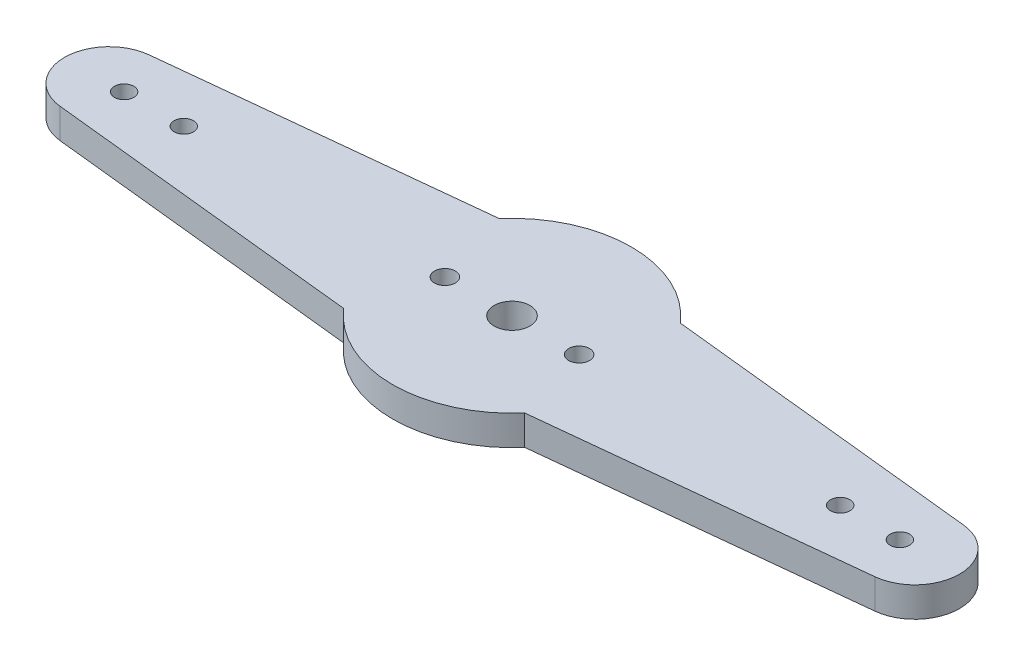
from build123d import *

# Parameters (mm, degrees)
BOSS_EXTRU_1_DEPTH      = 10
SYM_TRIE8_COPY_1_DEPTH  = 10
ESQUISSE2_R             = 3.5
ESQUISSE2_R_2           = 6
ESQUISSE2_R_3           = 3.25
ENL_V_MAT_EXTRU_1_DEPTH = 10


with BuildPart() as part:
    # Esquisse1 → Boss.-Extru.1 (new body)
    with BuildSketch(Plane(origin=(0, 0, 0), x_dir=(1, 0, 0), z_dir=(0, 1, 0))):
        with BuildLine():
            Line((-30.324962458, 26.084413966), (-136.567926949, 14.917828431))
            ThreePointArc((-136.567926949, 14.917828431), (-146.147172382, 10.036959095), (-150, 0))
            Line((-150, 0), (0, 0))
            Line((0, 0), (0, 40))
            ThreePointArc((0, 40), (-16.682677264, 36.355031004), (-30.324962458, 26.084413966))
        make_face()
    boss_extru_1 = extrude(amount=BOSS_EXTRU_1_DEPTH)

    # Symétrie1: Boss.-Extru.1 across plane
    add(boss_extru_1.mirror(Plane(origin=(-150, 10, 0), x_dir=(1, 0, 0), z_dir=(0, 0, -1))))

    # Symétrie8: Boss.-Extru.1 across plane
    add(boss_extru_1.mirror(Plane(origin=(0, 0, 0), x_dir=(0, 0, 1), z_dir=(1, 0, 0))))

    # Symétrie8 copy 1 sketch → Symétrie8 copy 1 (add)
    with BuildSketch(Plane(origin=(0, 0, 0), x_dir=(-1, 0, 0), z_dir=(0, 1, 0))):
        with BuildLine():
            Line((-30.324962458, 26.084413966), (-136.567926949, 14.917828431))
            ThreePointArc((-136.567926949, 14.917828431), (-146.147172382, 10.036959095), (-150, 0))
            Line((-150, 0), (0, 0))
            Line((0, 0), (0, 40))
            ThreePointArc((0, 40), (-16.682677264, 36.355031004), (-30.324962458, 26.084413966))
        make_face()
    extrude(amount=SYM_TRIE8_COPY_1_DEPTH)

    # Esquisse2 → Enlèv. mat.-Extru.1 (cut)
    with BuildSketch(Plane(origin=(0, 10, 0), x_dir=(1, 0, 0), z_dir=(0, 1, 0))):
        with Locations(Location((-22.5, 0, 0), (0, 0, 270))):
            Circle(ESQUISSE2_R)
        with Locations(Location((22.5, 0, 0), (0, 0, 270))):
            Circle(ESQUISSE2_R)
        with Locations(Location((0, 0, 0), (0, 0, 270))):
            Circle(ESQUISSE2_R_2)
        with Locations(Location((-110, 0, 0), (0, 0, 270))):
            Circle(ESQUISSE2_R_3)
        with Locations(Location((-130, 0, 0), (0, 0, 270))):
            Circle(ESQUISSE2_R_3)
        with Locations(Location((110, 0, 0), (0, 0, 270))):
            Circle(ESQUISSE2_R_3)
        with Locations(Location((130, 0, 0), (0, 0, 270))):
            Circle(ESQUISSE2_R_3)
    extrude(amount=-ENL_V_MAT_EXTRU_1_DEPTH, mode=Mode.SUBTRACT)


solid = part.part
